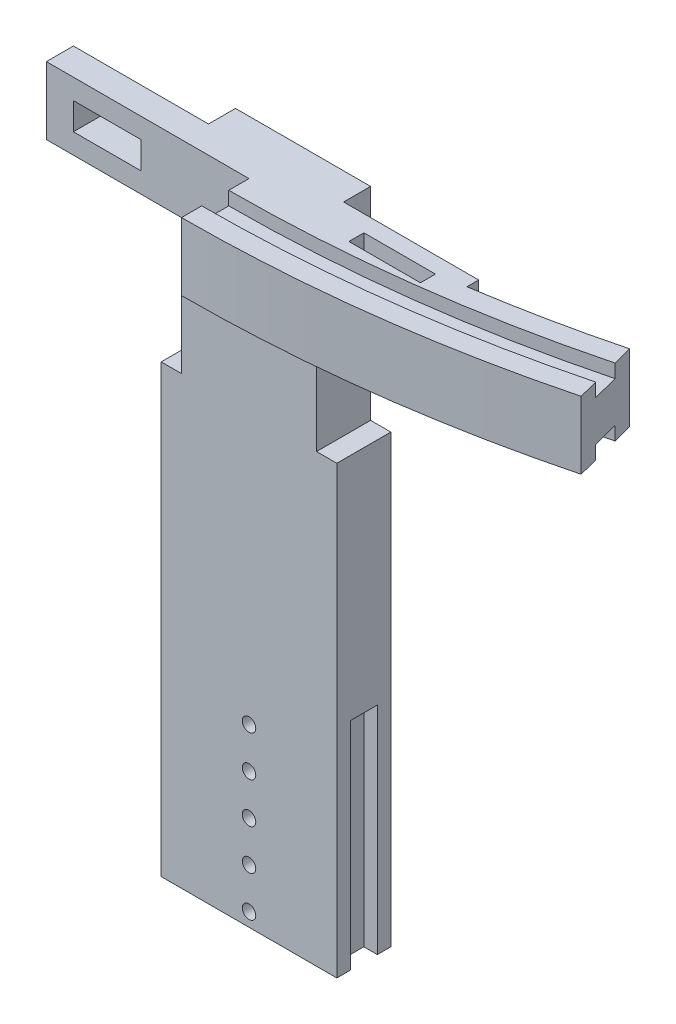
from build123d import *

# Parameters (mm, degrees)
BODY_DEPTH          = 160
SKETCH2_R           = 5
PIN_HOLE_DEPTH      = 178.270979012
LPATTERN1_COUNT     = 5
LPATTERN1_PITCH     = 30
SKETCH3_W           = 130
SKETCH3_H           = 170
SKETCH3_W_2         = 100
SKETCH3_H_2         = 150
SPINE_DEPTH         = 40
SKETCH10_W          = 300
SKETCH10_H          = 50
SKETCH10_W_2        = 50
SKETCH10_H_2        = 20
BOSS_EXTRUDE5_DEPTH = 20
CUT_EXTRUDE2_REACH  = 553.549
SKETCH11_W          = 52.942098854
SKETCH11_H          = 11.117065858


with BuildPart() as part:
    # Sketch1 → body (new body)
    with BuildSketch(Plane(origin=(0, 0, 0), x_dir=(1, 0, 0), z_dir=(0, 1, 0))):
        Polygon((65, 20), (-65, 20), (-65, 10), (-55, 10), (-55, -10), (-65, -10), (-65, -20), (65, -20), (65, -10), (55, -10), (55, 10), (65, 10), align=None)
    extrude(amount=BODY_DEPTH)

    # Sketch2 → pin hole (cut, through all)
    with BuildSketch(Plane.XY.offset(20)):
        with Locations((0, 10)):
            Circle(SKETCH2_R)
    pin_hole = extrude(amount=-PIN_HOLE_DEPTH, mode=Mode.SUBTRACT)

    # LPattern1: pin hole ×5
    with Locations(*[(0, i * LPATTERN1_PITCH, 0) for i in range(1, LPATTERN1_COUNT)]):
        add(pin_hole, mode=Mode.SUBTRACT)

    # Sketch3 → spine (add)
    with BuildSketch(Plane.XY.offset(20)):
        with Locations((0, 245)):
            Rectangle(SKETCH3_W, SKETCH3_H)
        with Locations((0, 405)):
            Rectangle(SKETCH3_W_2, SKETCH3_H_2)
    extrude(amount=-SPINE_DEPTH)

    # Sweep4: sweep along a path in Sketch8
    with BuildLine(Plane(origin=(0, 480, 0), x_dir=(1, 0, 0), z_dir=(0, 1, 0))) as sweep4_path:
        ThreePointArc((0, -20), (126.004292483, -12.029696267), (250, 11.754163448))
    # Sketch6<6> → Sweep4 (sweep)
    with BuildSketch(Plane(origin=(0, 0, 0), x_dir=(0, 0, -1), z_dir=(1, 0, 0))):
        Polygon((-70, 480), (-55, 480), (-55, 470), (-35, 470), (-35, 480), (-20, 480), (-20, 430), (-35, 430), (-35, 440), (-55, 440), (-55, 430), (-70, 430), align=None)
    sweep(path=sweep4_path.line)

    # Sketch10 → Boss-Extrude5 (add)
    with BuildSketch(Plane.XY.offset(20)):
        with Locations((0, 455)):
            Rectangle(SKETCH10_W, SKETCH10_H)
        with Locations((-105, 455)):
            Rectangle(SKETCH10_W_2, SKETCH10_H_2, mode=Mode.SUBTRACT)
        with Locations((105, 455)):
            Rectangle(SKETCH10_W_2, SKETCH10_H_2, mode=Mode.SUBTRACT)
    extrude(amount=-BOSS_EXTRUDE5_DEPTH)

    # Sketch11 → Cut-Extrude2 (cut, up to next)
    with BuildSketch(Plane(origin=(0, 480, 0), x_dir=(1, 0, 0), z_dir=(0, 1, 0)), mode=Mode.PRIVATE) as cut_extrude2_sk1:
        with Locations((103.759397545, -17.786929586)):
            Rectangle(SKETCH11_W, SKETCH11_H)
    cut_extrude2_tool1 = extrude(cut_extrude2_sk1.sketch, amount=-CUT_EXTRUDE2_REACH, mode=Mode.PRIVATE) & part.part
    add(cut_extrude2_tool1.solids().sort_by_distance((103.759398, 480, 17.78693))[0], mode=Mode.SUBTRACT)


solid = part.part
